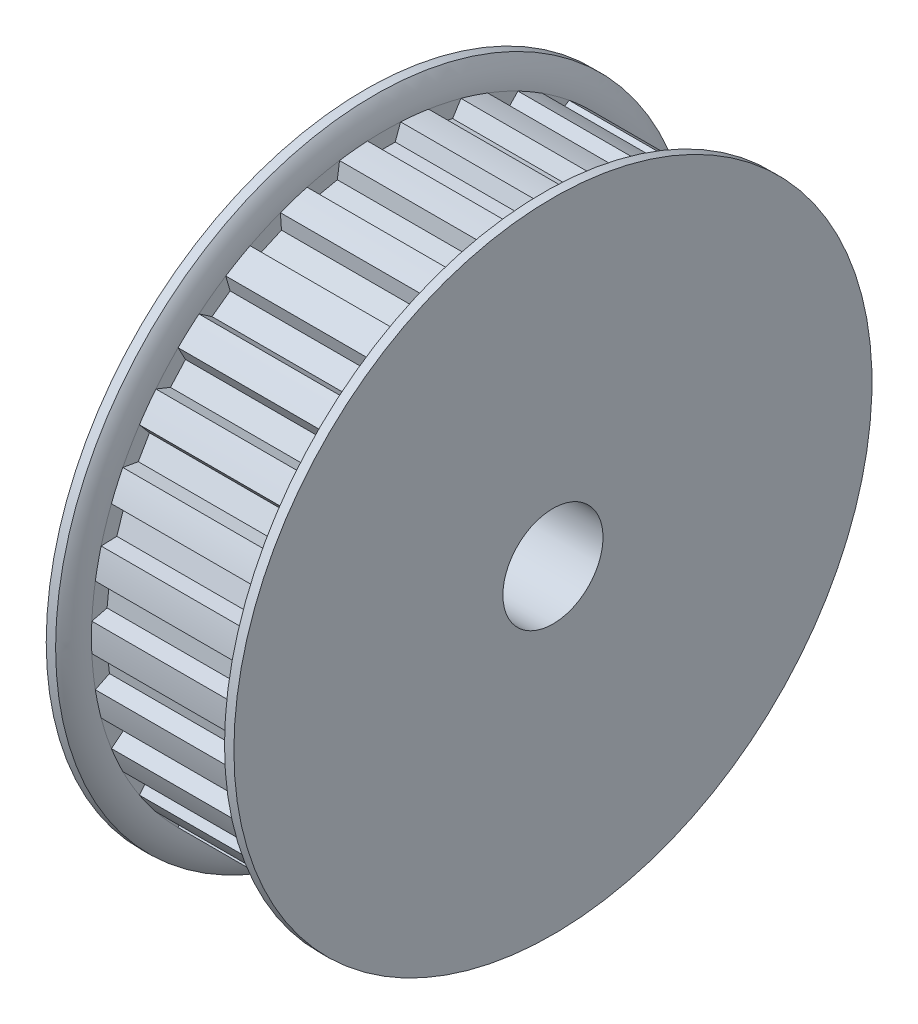
from build123d import *

# Parameters (mm, degrees)
CUT_EXTRUDE1_START = 9
CUT_EXTRUDE1_DEPTH = 12
CIRPATTERN1_COUNT  = 30


with BuildPart() as part:
    # Sketch6 → Revolve1 (revolve)
    with BuildSketch(Plane.XY, mode=Mode.PRIVATE) as revolve1_sk:
        with BuildLine():
            Line((9.75, 25.5), (10.5, 25.5))
            Line((10.5, 25.5), (10.5, 4))
            Line((10.5, 4), (-10.5, 4))
            Line((-10.5, 4), (-10.5, 17))
            Line((-10.5, 17), (-4.5, 17))
            Line((-4.5, 17), (-4.5, 25.5))
            Line((-4.5, 25.5), (-3.75, 25.5))
            ThreePointArc((-3.75, 25.5), (-3.193025968, 24.504377606), (-3, 23.38))
            Line((-3, 23.38), (9, 23.38))
            ThreePointArc((9, 23.38), (9.193025968, 24.504377606), (9.75, 25.5))
        make_face()
    revolve(revolve1_sk.sketch.rotate(Axis((-10.5, 0, 0), (1, 0, 0)), 90), axis=Axis((-10.5, 0, 0), (1, 0, 0)))

    # Sketch3 → Cut-Extrude1 (cut)
    with BuildSketch(Plane(origin=(0, 0, 0), x_dir=(0, 0, -1), z_dir=(1, 0, 0)).offset(CUT_EXTRUDE1_START)):
        with BuildLine():
            Line((-1.325, 23.34242436), (-0.895332226, 22.161921853))
            Line((-0.895332226, 22.161921853), (0.895332226, 22.161921853))
            Line((0.895332226, 22.161921853), (1.325, 23.34242436))
            ThreePointArc((1.325, 23.34242436), (0, 23.38), (-1.325, 23.34242436))
        make_face()
    cut_extrude1 = extrude(amount=-CUT_EXTRUDE1_DEPTH, mode=Mode.SUBTRACT)

    # CirPattern1: Cut-Extrude1 ×30 about axis
    cirpattern1_axis = Axis((0, 0, 0), (1, 0, 0))
    for i in range(1, CIRPATTERN1_COUNT):
        add(cut_extrude1.rotate(cirpattern1_axis, i * 360 / CIRPATTERN1_COUNT), mode=Mode.SUBTRACT)


solid = part.part
